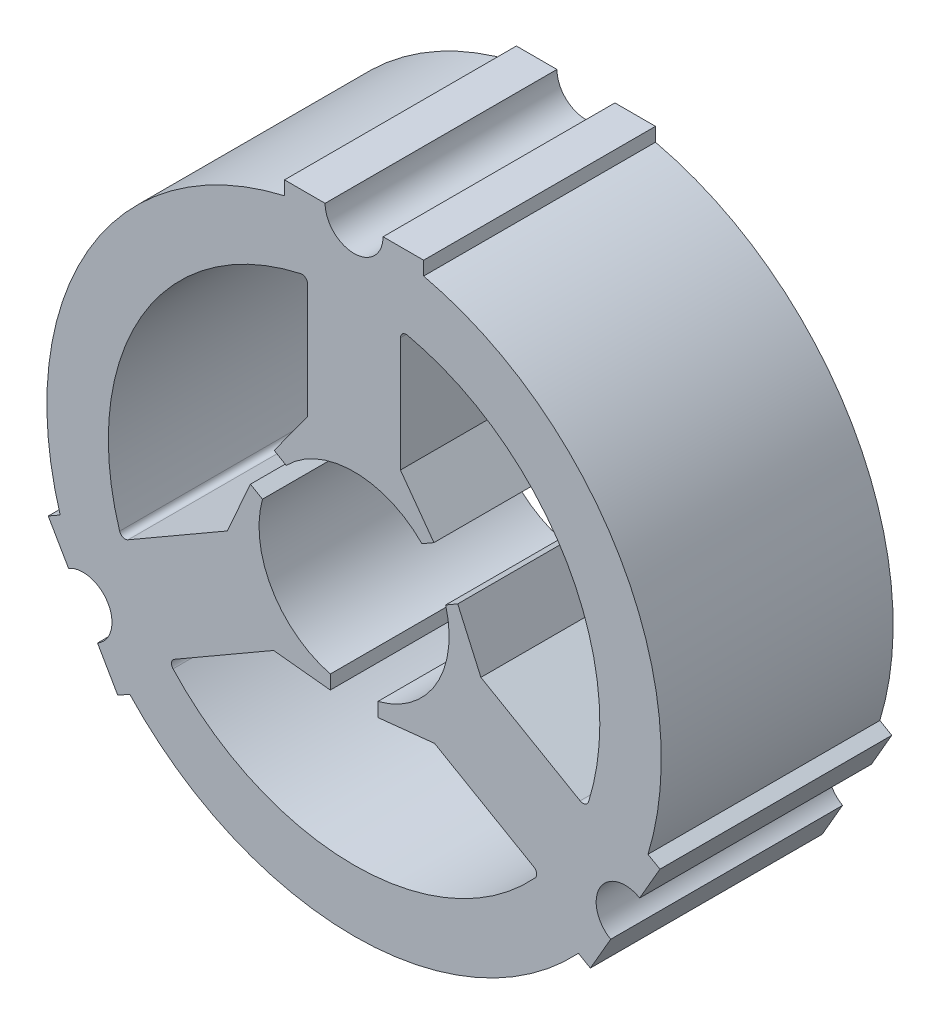
from build123d import *

# Parameters (mm, degrees)
SKETCH_1_R               = 4.1
EXTRUDE_1_DEPTH          = 10
CUT_EXTRUDE_1_DEPTH      = 10
PATTERN_CIRCULAR_1_COUNT = 3


with BuildPart() as part:
    # 草图1 → 凸台-拉伸1 (new body)
    with BuildSketch(Plane.XY):
        with BuildLine():
            Line((-3, 13.5), (-3, 12.905909499))
            ThreePointArc((-3, 12.905909499), (-11.4748366, 6.625), (-12.676845485, -3.854878538))
            Line((-12.676845485, -3.854878538), (-13.191342951, -4.151923789))
            Line((-13.191342951, -4.151923789), (-12.316342951, -5.667468245))
            ThreePointArc((-12.316342951, -5.667468245), (-10.608811196, -6.125), (-11.066342951, -7.832531755))
            Line((-11.066342951, -7.832531755), (-10.191342951, -9.348076211))
            Line((-10.191342951, -9.348076211), (-9.676845485, -9.051030961))
            ThreePointArc((-9.676845485, -9.051030961), (0, -13.25), (9.676845485, -9.051030961))
            Line((9.676845485, -9.051030961), (10.191342951, -9.348076211))
            Line((10.191342951, -9.348076211), (11.066342951, -7.832531755))
            ThreePointArc((11.066342951, -7.832531755), (10.608811196, -6.125), (12.316342951, -5.667468245))
            Line((12.316342951, -5.667468245), (13.191342951, -4.151923789))
            Line((13.191342951, -4.151923789), (12.676845485, -3.854878538))
            ThreePointArc((12.676845485, -3.854878538), (11.4748366, 6.625), (3, 12.905909499))
            Line((3, 12.905909499), (3, 13.5))
            Line((3, 13.5), (1.25, 13.5))
            ThreePointArc((1.25, 13.5), (0, 12.25), (-1.25, 13.5))
            Line((-1.25, 13.5), (-3, 13.5))
        make_face()
        Circle(SKETCH_1_R, mode=Mode.SUBTRACT)
    extrude(amount=EXTRUDE_1_DEPTH)

    # 草图2 → 切除-拉伸1 (cut)
    with BuildSketch(Plane.XY):
        with BuildLine():
            Line((-7.748999943, -6.78328828), (-3.470031597, -4.312824754))
            Line((-3.470031597, -4.312824754), (-1.025, -4.56980793))
            Line((-1.025, -4.56980793), (-1.025, -3.96980793))
            ThreePointArc((-1.025, -3.96980793), (0, -4.1), (1.025, -3.96980793))
            Line((1.025, -3.96980793), (1.025, -4.56980793))
            Line((1.025, -4.56980793), (3.470031597, -4.312824754))
            Line((3.470031597, -4.312824754), (7.748999943, -6.78328828))
            ThreePointArc((7.748999943, -6.78328828), (7.871108829, -6.961884233), (7.808154531, -7.168871796))
            ThreePointArc((7.808154531, -7.168871796), (0, -10.6), (-7.808154531, -7.168871796))
            ThreePointArc((-7.808154531, -7.168871796), (-7.871108829, -6.961884233), (-7.748999943, -6.78328828))
        make_face()
    cut_extrude_1 = extrude(amount=CUT_EXTRUDE_1_DEPTH, mode=Mode.SUBTRACT)

    # 阵列(圆周)1: 切除-拉伸1 ×3 about axis
    pattern_circular_1_axis = Axis((0, 0, 0), (0, 0, 1))
    for i in range(1, PATTERN_CIRCULAR_1_COUNT):
        add(cut_extrude_1.rotate(pattern_circular_1_axis, i * 360 / PATTERN_CIRCULAR_1_COUNT), mode=Mode.SUBTRACT)


solid = part.part
